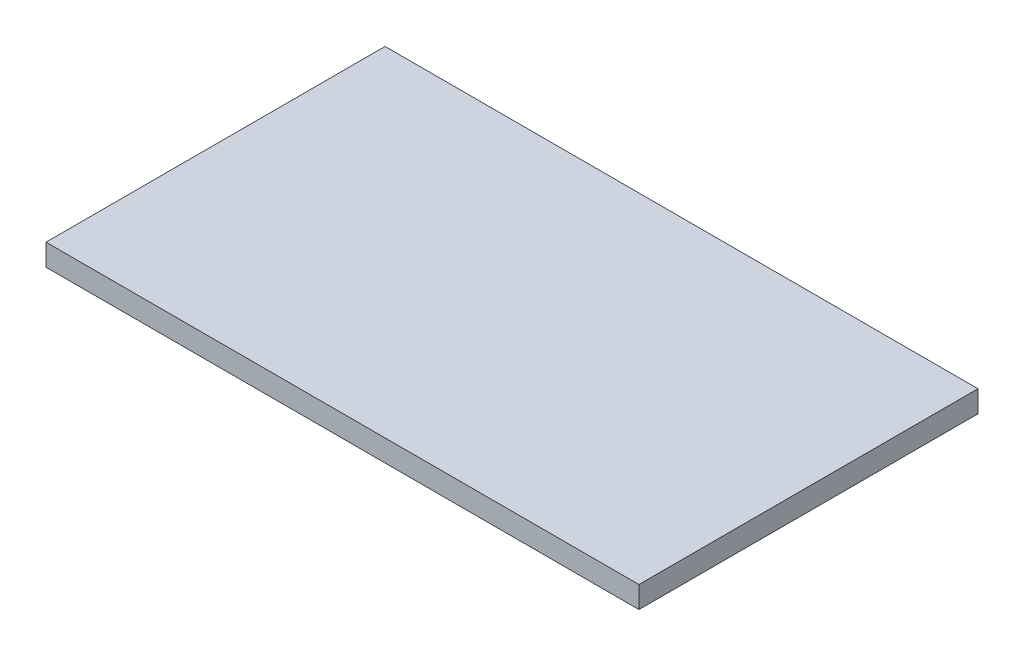
from build123d import *

# Parameters (mm, degrees)
SKETCH_1_W      = 71
SKETCH_1_H      = 40.6
EXTRUDE_1_DEPTH = 2.6


with BuildPart() as part:
    # 草图1 → 凸台-拉伸1 (new body)
    with BuildSketch(Plane(origin=(0, 0, 0), x_dir=(1, 0, 0), z_dir=(0, 1, 0))):
        with Locations((-10.499491094, -7.851399491)):
            Rectangle(SKETCH_1_W, SKETCH_1_H)
    extrude(amount=EXTRUDE_1_DEPTH)


solid = part.part
